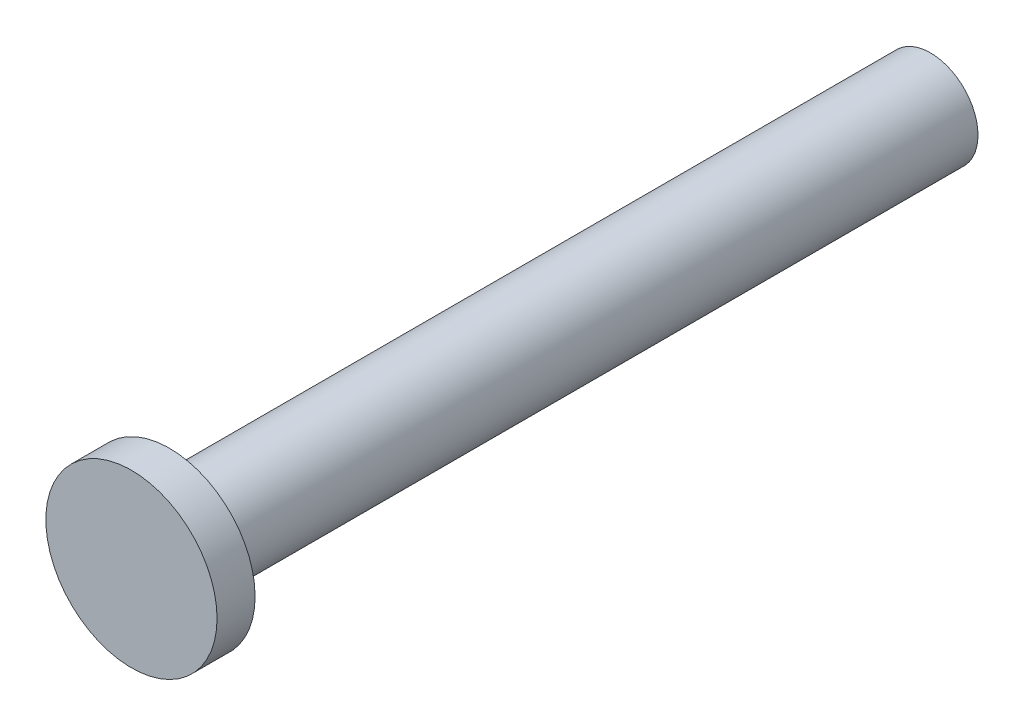
from build123d import *

# Parameters (mm, degrees)
SKETCH1_R           = 2.5
BOSS_EXTRUDE1_DEPTH = 40
SKETCH2_R           = 4.5
BOSS_EXTRUDE2_DEPTH = 2


with BuildPart() as part:
    # Sketch1 → Boss-Extrude1 (new body)
    with BuildSketch(Plane.XY):
        Circle(SKETCH1_R)
    extrude(amount=BOSS_EXTRUDE1_DEPTH)

    # Sketch2 → Boss-Extrude2 (add)
    with BuildSketch(Plane.XY.offset(40)):
        Circle(SKETCH2_R)
    extrude(amount=BOSS_EXTRUDE2_DEPTH)


solid = part.part
